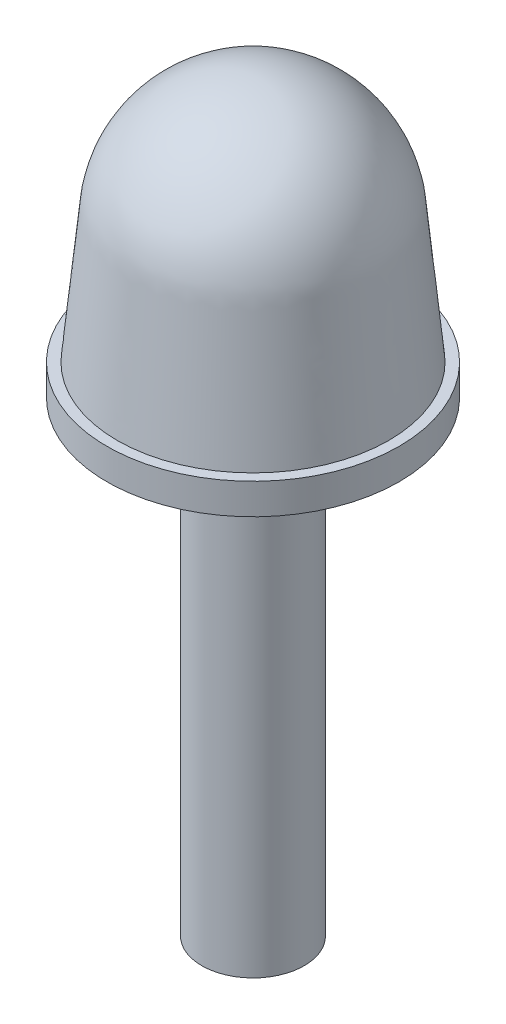
from build123d import *


with BuildPart() as part:
    # Sketch1 → Revolve1 (revolve)
    with BuildSketch(Plane.XY, mode=Mode.PRIVATE) as revolve1_sk:
        with BuildLine():
            Line((0, 0), (0, -72.5))
            Line((0, -72.5), (5, -72.5))
            Line((5, -72.5), (5, -30))
            Line((5, -30), (9, -30))
            Line((9, -30), (9, -27))
            Line((9, -27), (14.25, -27))
            Line((14.25, -27), (14.25, -24))
            Line((14.25, -24), (13.25, -24))
            add(Edge.make_bspline(
                [(13.25, -24), (12.876288893, -20.234768096), (12.502577786, -16.469536192), (12.12886668, -12.704304288), (12.10802883, -12.494357794), (12.06635313, -12.074464806), (12.003839581, -11.444625323), (11.962163881, -11.024732334), (11.941326032, -10.81478584), (11.913600396, -10.535443194), (11.858149124, -9.976757903), (11.666555139, -9.148985732), (11.514124842, -8.608285073), (11.428528654, -8.340938262), (9.779050122, -3.189040311), (5.409513095, 0), (0, 0)],
                knots=[0, 0, 0, 0, 0.379321245, 0.379321245, 0.379321245, 0.400471912, 0.421622579, 0.442773246, 0.442773246, 0.442773246, 0.470915098, 0.499056951, 0.527198803, 0.527198803, 0.527198803, 1, 1, 1, 1], degree=3, weights=[1, 1, 1, 1, 1, 1, 1, 1, 1, 1, 1, 1, 1, 1, 0.871833681, 0.871833681, 1]))
        make_face()
    revolve(revolve1_sk.sketch.rotate(Axis((0, 0, 0), (0, -1, 0)), 180), axis=Axis((0, 0, 0), (0, -1, 0)))


solid = part.part
